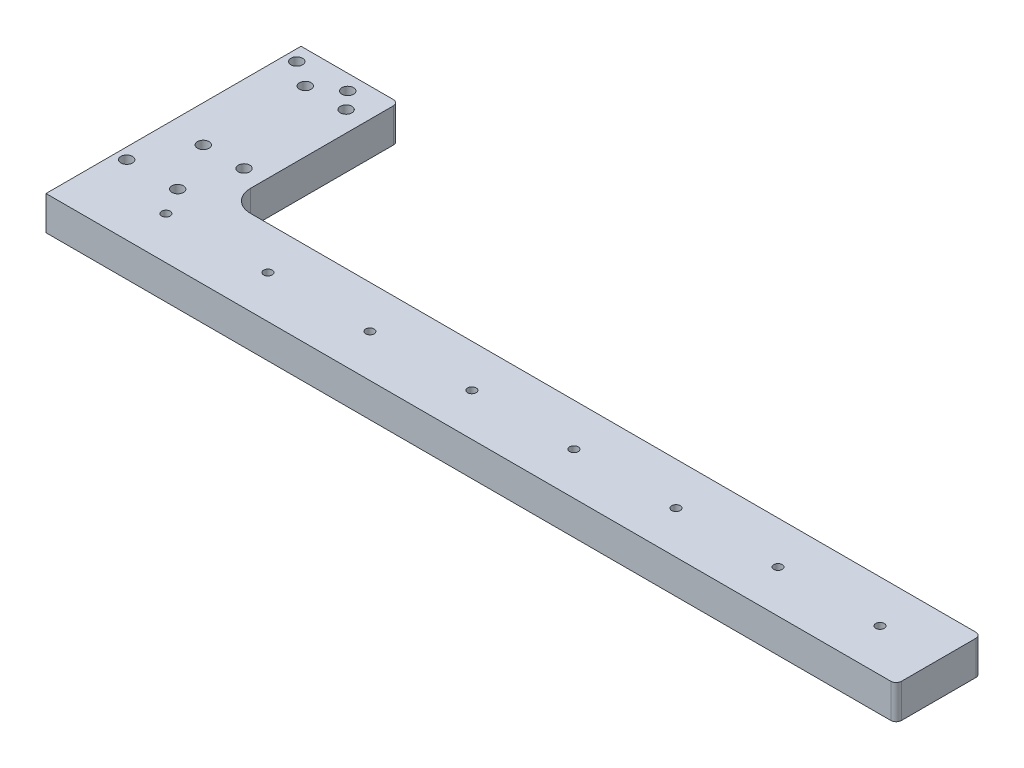
from build123d import *

# Parameters (mm, degrees)
BOSS_EXTRUDE1_DEPTH            = 10
LPATTERN2_COUNT                = 8
LPATTERN2_PITCH                = 60
M8_TAPPED_HOLE2_D              = 6.8
F_6_8_6_8_DIAMETER_HOLE1_D     = 6.8
F_6_8_6_8_DIAMETER_HOLE1_DEPTH = 8.0000094
F_6_8_6_8_DIAMETER_HOLE1_TIP   = 2.042926105
M6_TAPPED_HOLE1_D              = 5


with BuildPart() as part:
    # Sketch1 → Boss-Extrude1 (new, symmetric)
    with BuildSketch(Plane(origin=(0, 0, 0), x_dir=(1, 0, 0), z_dir=(0, 1, 0))):
        with BuildLine():
            Line((0, 0), (496.825, 0))
            ThreePointArc((496.825, 0), (499.07006403, 0.92993597), (500, 3.175))
            Line((500, 3.175), (500, 46.825))
            ThreePointArc((500, 46.825), (499.07006403, 49.07006403), (496.825, 50))
            Line((496.825, 50), (70.2, 50))
            ThreePointArc((70.2, 50), (61.219743879, 53.719743879), (57.5, 62.7))
            Line((57.5, 62.7), (57.5, 146.825))
            ThreePointArc((57.5, 146.825), (56.57006403, 149.07006403), (54.325, 150))
            Line((54.325, 150), (0, 150))
            Line((0, 150), (0, 0))
        make_face()
    extrude(amount=BOSS_EXTRUDE1_DEPTH, both=True)

    # Sketch3 → M6 Tapped Hole2 (revolve, cut)
    with BuildSketch(Plane(origin=(45.5, 10, -25), x_dir=(0, 0, 1), z_dir=(1, 0, 0))):
        Polygon((0, 0), (0, 29.492951548), (2.5, 27.9908), (2.5, 0), align=None)
    m6_tapped_hole2 = revolve(axis=Axis((45.5, 16.35, -25), (0, -1, 0)), mode=Mode.SUBTRACT)

    # LPattern2: M6 Tapped Hole2 ×8
    with Locations(*[(i * LPATTERN2_PITCH, 0, 0) for i in range(1, LPATTERN2_COUNT)]):
        add(m6_tapped_hole2, mode=Mode.SUBTRACT)

    # M8 Tapped Hole2 (through all)
    with Locations(Plane(origin=(0, 10, 0), x_dir=(1, 0, 0), z_dir=(0, 1, 0))):
        with Locations((45.5, 131), (21.5, 131), (45.5, 71), (21.5, 71)):
            Hole(M8_TAPPED_HOLE2_D / 2)

    # Ø6.8 (6.8) Diameter Hole1
    with Locations(Plane(origin=(0, 10, 0), x_dir=(1, 0, 0), z_dir=(0, 1, 0))):
        with Locations((36.5, 140.950000036), (6.5, 140.950000036), (6.5, 40.950000036), (36.5, 40.950000036)):
            Hole(F_6_8_6_8_DIAMETER_HOLE1_D / 2, depth=F_6_8_6_8_DIAMETER_HOLE1_DEPTH)
            with Locations((0, 0, -(F_6_8_6_8_DIAMETER_HOLE1_DEPTH + F_6_8_6_8_DIAMETER_HOLE1_TIP / 2))):  # 118° drill point
                Cone(0, F_6_8_6_8_DIAMETER_HOLE1_D / 2, F_6_8_6_8_DIAMETER_HOLE1_TIP, mode=Mode.SUBTRACT)

    # M6 Tapped Hole1 (through all)
    with Locations(Plane(origin=(0, 10, 0), x_dir=(1, 0, 0), z_dir=(0, 1, 0))):
        with Locations((6.5, 140.950000036), (36.5, 140.950000036), (36.5, 40.950000036), (6.5, 40.950000036)):
            Hole(M6_TAPPED_HOLE1_D / 2)


solid = part.part
